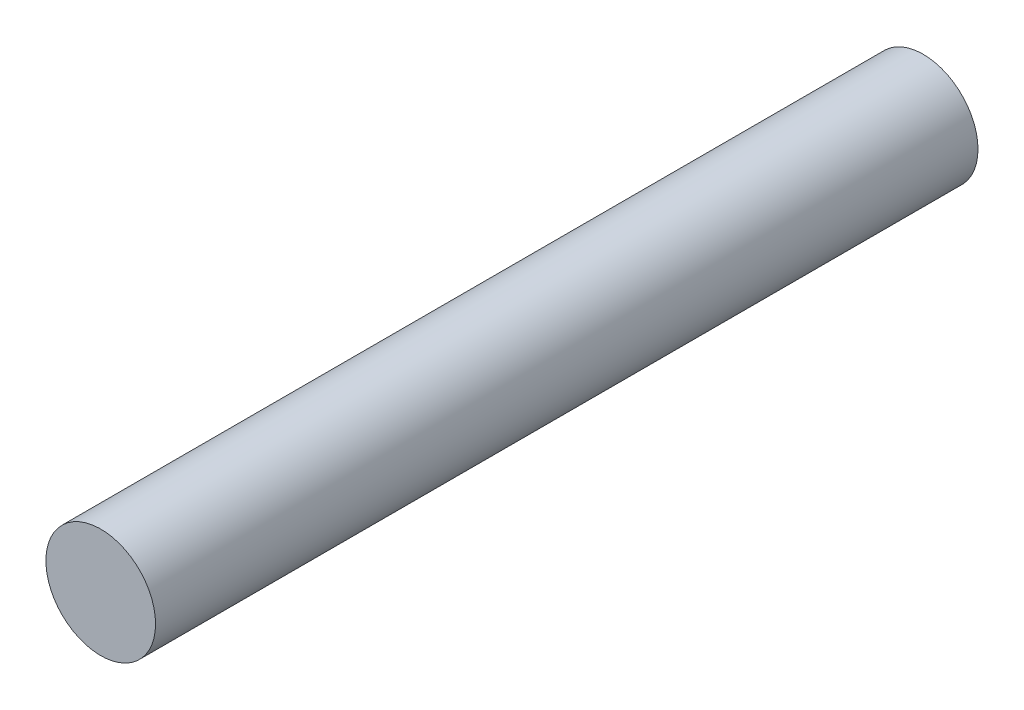
from build123d import *

# Parameters (mm, degrees)
ESBO_O1_R                = 5
RESSALTO_EXTRUS_O1_DEPTH = 75


with BuildPart() as part:
    # Esboço1 → Ressalto-extrusão1 (new body)
    with BuildSketch(Plane.XY):
        Circle(ESBO_O1_R)
    extrude(amount=RESSALTO_EXTRUS_O1_DEPTH)


solid = part.part
